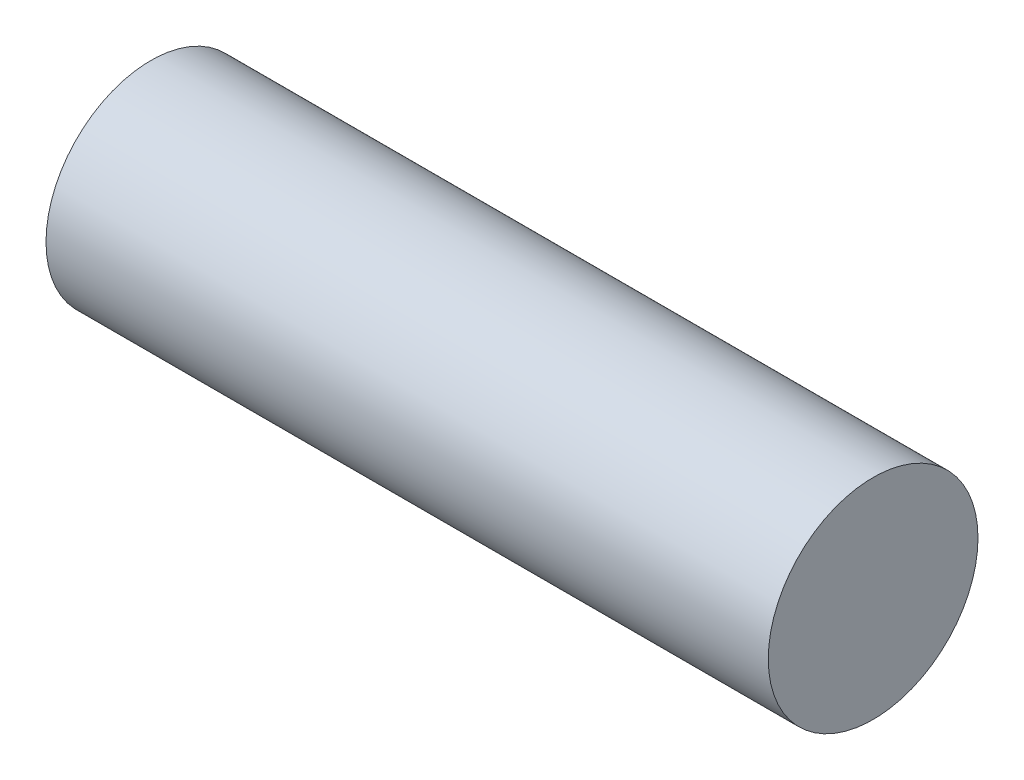
from build123d import *

# Parameters (mm, degrees)
SKETCH1_R           = 4
BOSS_EXTRUDE1_DEPTH = 27.55


with BuildPart() as part:
    # Sketch1 → Boss-Extrude1 (new body)
    with BuildSketch(Plane(origin=(0, 0, 0), x_dir=(0, 0, -1), z_dir=(1, 0, 0))):
        Circle(SKETCH1_R)
    extrude(amount=BOSS_EXTRUDE1_DEPTH)


solid = part.part
